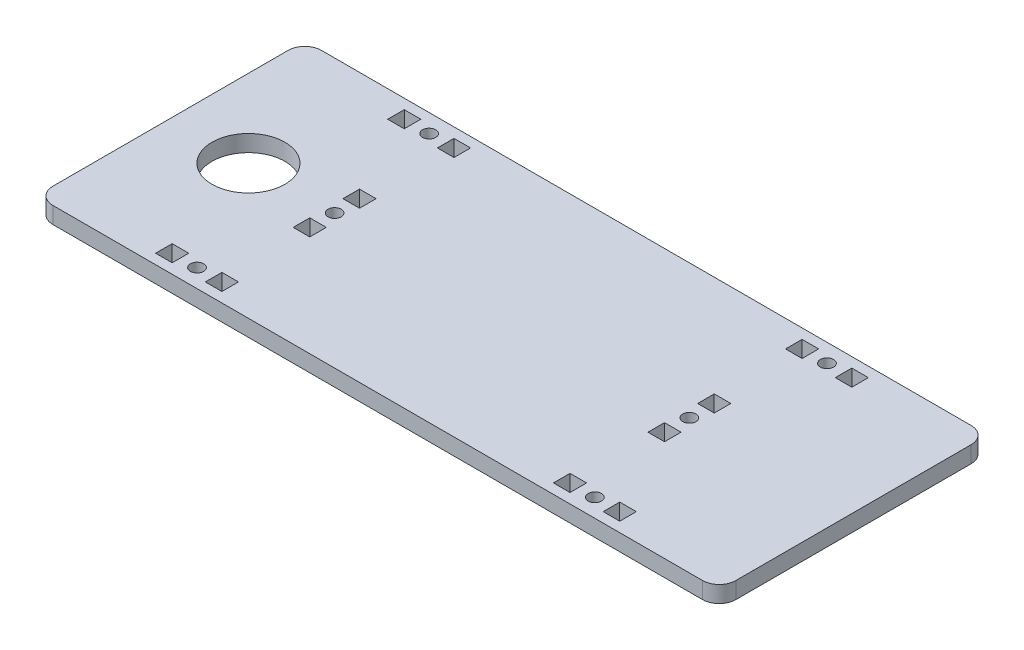
from build123d import *

# Parameters (mm, degrees)
SKETCH1_W           = 206
SKETCH1_H           = 81
SKETCH1_R           = 2
SKETCH1_R_2         = 11
SKETCH1_W_2         = 5
SKETCH1_H_2         = 5
BOSS_EXTRUDE4_DEPTH = 5
FILLET9_R           = 5


with BuildPart() as part:
    # Sketch1 → Boss-Extrude4 (new body)
    with BuildSketch(Plane(origin=(0, 0, 0), x_dir=(1, 0, 0), z_dir=(0, 1, 0))):
        with Locations((5.102707087, 13.156325227)):
            Rectangle(SKETCH1_W, SKETCH1_H)
        with Locations(Location((-54.897292913, 48.156325227, 0), (0, 0, 270))):
            Circle(SKETCH1_R, mode=Mode.SUBTRACT)
        with Locations(Location((-54.897292913, -21.843674773, 0), (0, 0, 90))):
            Circle(SKETCH1_R, mode=Mode.SUBTRACT)
        with Locations(Location((65.102707087, -21.843674773, 0), (0, 0, 270))):
            Circle(SKETCH1_R, mode=Mode.SUBTRACT)
        with Locations(Location((65.102707087, 48.156325227, 0), (0, 0, 90))):
            Circle(SKETCH1_R, mode=Mode.SUBTRACT)
        with Locations(Location((-48.397292913, 13.156325227, 0), (0, 0, 270))):
            Circle(SKETCH1_R, mode=Mode.SUBTRACT)
        with Locations(Location((58.602707087, 13.156325227, 0), (0, 0, 90))):
            Circle(SKETCH1_R, mode=Mode.SUBTRACT)
        with Locations(Location((-74.397292913, 13.156325227, 0), (0, 0, 270))):
            Circle(SKETCH1_R_2, mode=Mode.SUBTRACT)
        with Locations((57.602707087, 48.156325227)):
            Rectangle(SKETCH1_W_2, SKETCH1_H_2, mode=Mode.SUBTRACT)
        with Locations((-62.397292913, 48.156325227)):
            Rectangle(SKETCH1_W_2, SKETCH1_H_2, mode=Mode.SUBTRACT)
        with Locations((-47.397292913, 48.156325227)):
            Rectangle(SKETCH1_W_2, SKETCH1_H_2, mode=Mode.SUBTRACT)
        with Locations((72.602707087, 48.156325227)):
            Rectangle(SKETCH1_W_2, SKETCH1_H_2, mode=Mode.SUBTRACT)
        with Locations((72.602707087, -21.843674773)):
            Rectangle(SKETCH1_W_2, SKETCH1_H_2, mode=Mode.SUBTRACT)
        with Locations((57.602707087, -21.843674773)):
            Rectangle(SKETCH1_W_2, SKETCH1_H_2, mode=Mode.SUBTRACT)
        with Locations((-47.397292913, -21.843674773)):
            Rectangle(SKETCH1_W_2, SKETCH1_H_2, mode=Mode.SUBTRACT)
        with Locations((-62.397292913, -21.843674773)):
            Rectangle(SKETCH1_W_2, SKETCH1_H_2, mode=Mode.SUBTRACT)
        with Locations((-48.397292913, 20.656325227)):
            Rectangle(SKETCH1_W_2, SKETCH1_H_2, mode=Mode.SUBTRACT)
        with Locations((-48.397292913, 5.656325227)):
            Rectangle(SKETCH1_W_2, SKETCH1_H_2, mode=Mode.SUBTRACT)
        with Locations((58.602707087, 5.656325227)):
            Rectangle(SKETCH1_W_2, SKETCH1_H_2, mode=Mode.SUBTRACT)
        with Locations((58.602707087, 20.656325227)):
            Rectangle(SKETCH1_W_2, SKETCH1_H_2, mode=Mode.SUBTRACT)
    extrude(amount=BOSS_EXTRUDE4_DEPTH)

    # Fillet9
    fillet9_edges = [part.edges().sort_by_distance(p)[0] for p in [
        (-97.897292913, 2.5, -53.656325227),
        (108.102707087, 2.5, -53.656325227),
        (108.102707087, 2.5, 27.343674773),
        (-97.897292913, 2.5, 27.343674773),
    ]]
    fillet(fillet9_edges, radius=FILLET9_R)


solid = part.part
